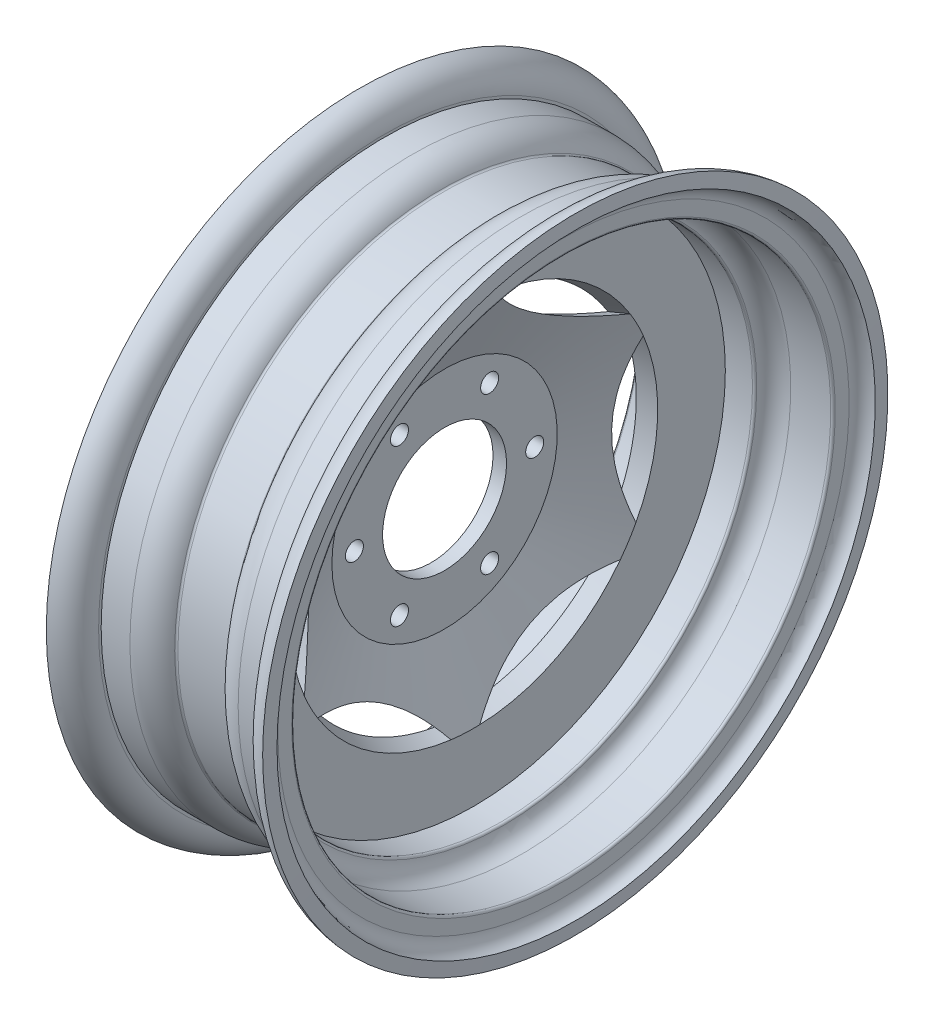
from build123d import *

# Parameters (mm, degrees)
SKETCH2_R          = 27.5
SKETCH2_R_2        = 4
CUT_EXTRUDE1_DEPTH = 205.68150882
CUT_EXTRUDE3_DEPTH = 218.124225294
CIRPATTERN1_COUNT  = 6


with BuildPart() as part:
    # Sketch1 → Revolve1 (revolve)
    with BuildSketch(Plane.XY, mode=Mode.PRIVATE) as revolve1_sk:
        with BuildLine():
            Line((-15.055633267, 111.584987884), (-3, 111.584987884))
            Line((-3, 111.584987884), (-3, 81.584987884))
            Line((-3, 81.584987884), (-16, 50))
            Line((-16, 50), (-16, 0))
            Line((-16, 0), (-10, 0))
            Line((-10, 0), (-10, 50))
            Line((-10, 50), (3, 81.584987884))
            Line((3, 81.584987884), (3, 111.584987884))
            Line((3, 111.584987884), (15.055633267, 111.584987884))
            ThreePointArc((15.055633267, 111.584987884), (15.722370389, 111.839694915), (16.049462246, 112.474064664))
            ThreePointArc((16.049462246, 112.474064664), (18.671183612, 117.558693622), (24.015244992, 119.600232876))
            Line((24.015244992, 119.600232876), (41.767761414, 119.600232876))
            ThreePointArc((41.767761414, 119.600232876), (42.474868196, 119.893126095), (42.767761414, 120.600232876))
            Line((42.767761414, 120.600232876), (42.767761414, 126.743442832))
            ThreePointArc((42.767761414, 126.743442832), (44.391502496, 130.848117956), (48.383880707, 132.731149872))
            Line((48.383880707, 132.731149872), (48, 138.718856913))
            ThreePointArc((48, 138.718856913), (40.015243577, 134.952793081), (36.767761414, 126.743442832))
            Line((36.767761414, 126.743442832), (36.767761414, 125.600232876))
            Line((36.767761414, 125.600232876), (24.015244992, 125.600232876))
            ThreePointArc((24.015244992, 125.600232876), (16.774589484, 123.584987884), (11.616194366, 118.118795024))
            ThreePointArc((11.616194366, 118.118795024), (11.248138358, 117.728777378), (10.731511248, 117.584987884))
            Line((10.731511248, 117.584987884), (-10.731511248, 117.584987884))
            ThreePointArc((-10.731511248, 117.584987884), (-11.248138358, 117.728777378), (-11.616194366, 118.118795024))
            ThreePointArc((-11.616194366, 118.118795024), (-16.774589484, 123.584987884), (-24.015244992, 125.600232876))
            Line((-24.015244992, 125.600232876), (-36.767761414, 125.600232876))
            Line((-36.767761414, 125.600232876), (-36.767761414, 126.743442832))
            ThreePointArc((-36.767761414, 126.743442832), (-40.015243577, 134.952793081), (-48, 138.718856913))
            Line((-48, 138.718856913), (-48.383880707, 132.731149872))
            ThreePointArc((-48.383880707, 132.731149872), (-44.391502496, 130.848117956), (-42.767761414, 126.743442832))
            Line((-42.767761414, 126.743442832), (-42.767761414, 120.600232876))
            ThreePointArc((-42.767761414, 120.600232876), (-42.474868196, 119.893126095), (-41.767761414, 119.600232876))
            Line((-41.767761414, 119.600232876), (-24.015244992, 119.600232876))
            ThreePointArc((-24.015244992, 119.600232876), (-18.671183612, 117.558693622), (-16.049462246, 112.474064664))
            ThreePointArc((-16.049462246, 112.474064664), (-15.722370389, 111.839694915), (-15.055633267, 111.584987884))
        make_face()
    revolve(revolve1_sk.sketch.rotate(Axis((0, 0, 0), (1, 0, 0)), 90), axis=Axis((0, 0, 0), (1, 0, 0)))

    # Sketch2 → Cut-Extrude1 (cut, through all)
    with BuildSketch(Plane(origin=(-10, 0, 0), x_dir=(0, 0, -1), z_dir=(1, 0, 0))):
        Circle(SKETCH2_R)
        with Locations((20, 34.641016151)):
            Circle(SKETCH2_R_2)
        with Locations((40, 0)):
            Circle(SKETCH2_R_2)
        with Locations((20, -34.641016151)):
            Circle(SKETCH2_R_2)
        with Locations((-20, -34.641016151)):
            Circle(SKETCH2_R_2)
        with Locations((-40, 0)):
            Circle(SKETCH2_R_2)
        with Locations((-20, 34.641016151)):
            Circle(SKETCH2_R_2)
    extrude(amount=-CUT_EXTRUDE1_DEPTH, mode=Mode.SUBTRACT)

    # Sketch3 → Cut-Extrude3 (cut, through all)
    with BuildSketch(Plane(origin=(-26.149543165, -10.762836522, 0), x_dir=(0, 0, -1), z_dir=(0.9247356390520342, 0.38061003384964265, 0))):
        with BuildLine():
            ThreePointArc((-65.025250644, 44.422654944), (-32.059376581, 55.693322861), (-2.582720962, 74.264902803))
            add(Edge.make_bspline(
                [(-2.582720962, 74.264902803), (-41.505923005, 73.124886363), (-65.025250644, 44.422654944)],
                knots=[1.602458433, 1.602458433, 1.602458433, 2.49314898, 2.49314898, 2.49314898], degree=2, weights=[1, 0.902461986, 1]))
        make_face()
    cut_extrude3 = extrude(amount=CUT_EXTRUDE3_DEPTH, mode=Mode.SUBTRACT)

    # CirPattern1: Cut-Extrude3 ×6 about axis
    cirpattern1_axis = Axis((-10, 0, 0), (1, 0, 0))
    for i in range(1, CIRPATTERN1_COUNT):
        add(cut_extrude3.rotate(cirpattern1_axis, i * 360 / CIRPATTERN1_COUNT), mode=Mode.SUBTRACT)


solid = part.part
